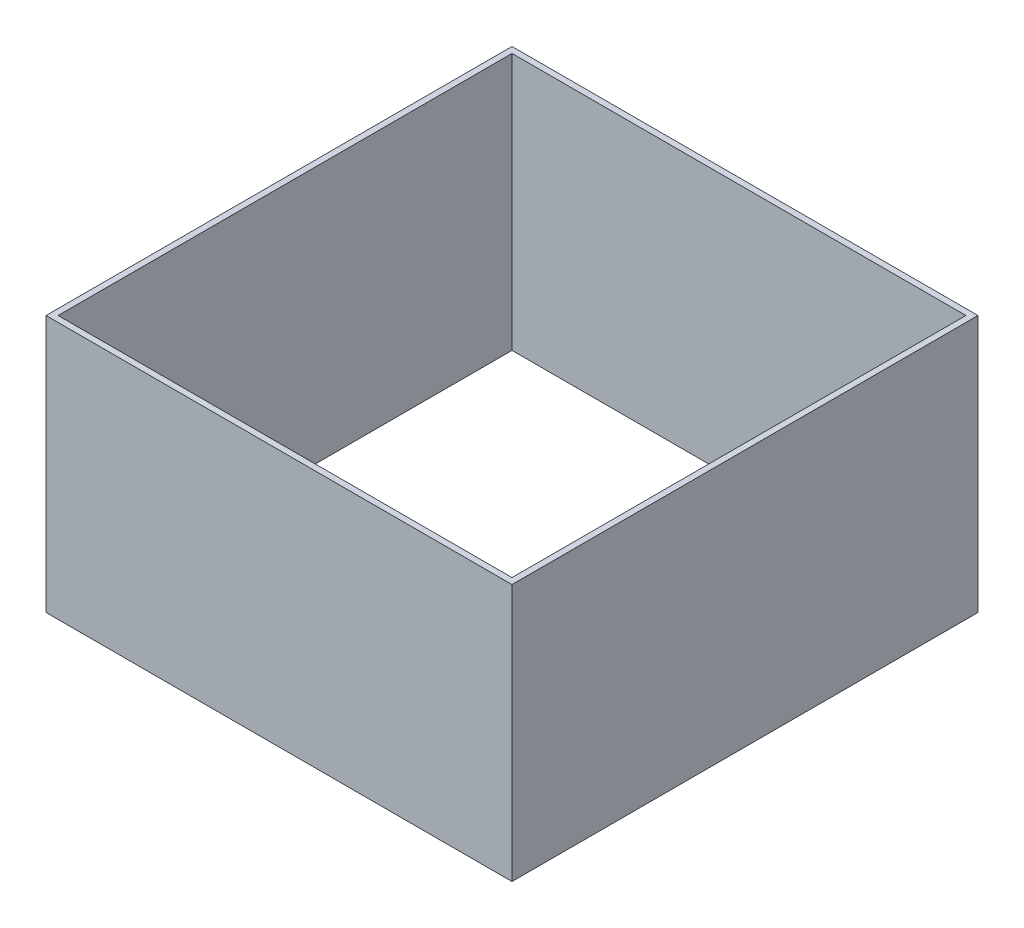
from build123d import *

# Parameters (mm, degrees)
SKETCH1_W           = 77
SKETCH1_H           = 77
SKETCH1_W_2         = 75
SKETCH1_H_2         = 75
BOSS_EXTRUDE1_DEPTH = 42.5


with BuildPart() as part:
    # Sketch1 → Boss-Extrude1 (new body)
    with BuildSketch(Plane(origin=(0, 0, 0), x_dir=(1, 0, 0), z_dir=(0, 1, 0))):
        with Locations((38.5, 38.5)):
            Rectangle(SKETCH1_W, SKETCH1_H)
        with Locations((38.5, 38.5)):
            Rectangle(SKETCH1_W_2, SKETCH1_H_2, mode=Mode.SUBTRACT)
    extrude(amount=BOSS_EXTRUDE1_DEPTH)


solid = part.part
